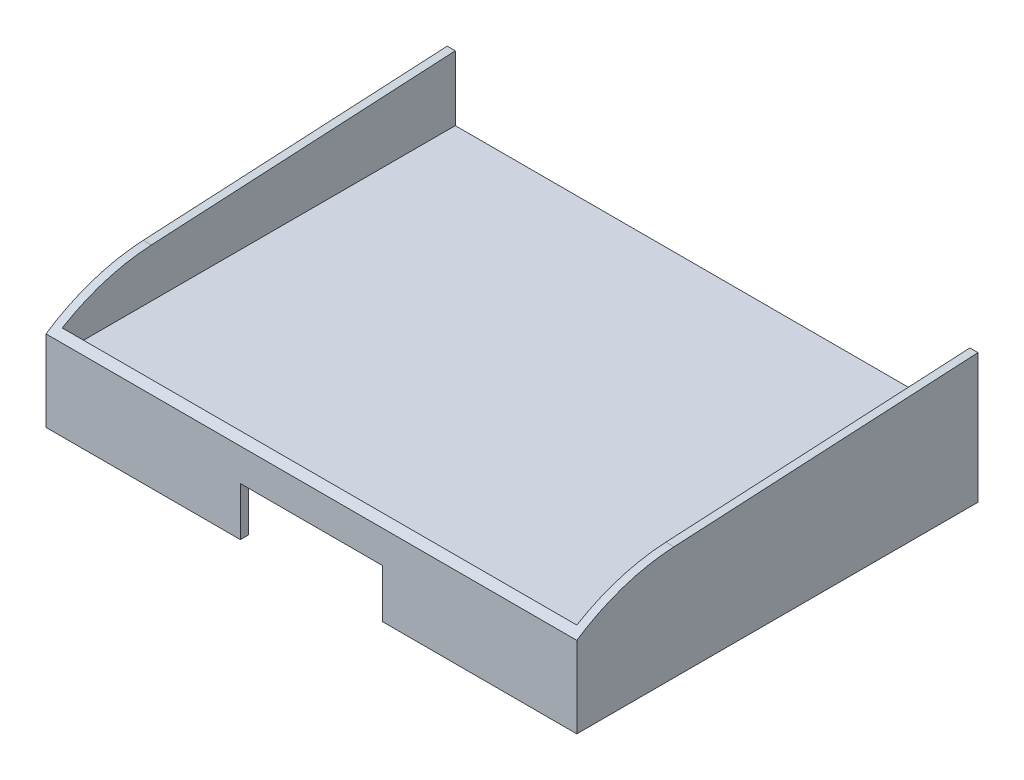
from build123d import *

# Parameters (mm, degrees)
SKETCH1_W           = 416.08
SKETCH1_H           = 314.48
BOSS_EXTRUDE2_DEPTH = 101.6
SKETCH2_W           = 403.38
SKETCH2_H           = 308.13
CUT_EXTRUDE1_DEPTH  = 320.090106675
CUT_EXTRUDE2_DEPTH  = 462.687674829
CUT_EXTRUDE3_REACH  = 415.528
SKETCH4_W           = 111.28
SKETCH4_H           = 38.1
SKETCH5_W           = 403.38
SKETCH5_H           = 12.7
BOSS_EXTRUDE3_DEPTH = 308.13


with BuildPart() as part:
    # Sketch1 → Boss-Extrude2 (new body)
    with BuildSketch(Plane(origin=(0, 0, 0), x_dir=(1, 0, 0), z_dir=(0, 1, 0))):
        with Locations((40.527, 15.127)):
            Rectangle(SKETCH1_W, SKETCH1_H)
    extrude(amount=BOSS_EXTRUDE2_DEPTH)

    # Sketch2 → Cut-Extrude1 (cut, through all)
    with BuildSketch(Plane(origin=(0, 101.6, 0), x_dir=(1, 0, 0), z_dir=(0, 1, 0))):
        with Locations((40.527, 18.302)):
            Rectangle(SKETCH2_W, SKETCH2_H)
    extrude(amount=-CUT_EXTRUDE1_DEPTH, mode=Mode.SUBTRACT)

    # Sketch3 → Cut-Extrude2 (cut, through all)
    with BuildSketch(Plane(origin=(248.567, 0, 0), x_dir=(0, 0, -1), z_dir=(1, 0, 0))):
        with BuildLine():
            Line((-142.113, 63.5), (-142.113, 101.6))
            Line((-142.113, 101.6), (172.367, 101.6))
            Line((172.367, 101.6), (-65.913, 88.9))
            ThreePointArc((-65.913, 88.9), (-105.728307199, 81.345921598), (-142.113, 63.5))
        make_face()
    extrude(amount=-CUT_EXTRUDE2_DEPTH, mode=Mode.SUBTRACT)

    # Sketch4 → Cut-Extrude3 (cut, up to next)
    with BuildSketch(Plane.XY.offset(142.113), mode=Mode.PRIVATE) as cut_extrude3_sk1:
        with Locations((40.527, 19.05)):
            Rectangle(SKETCH4_W, SKETCH4_H)
    cut_extrude3_tool1 = extrude(cut_extrude3_sk1.sketch, amount=-CUT_EXTRUDE3_REACH, mode=Mode.PRIVATE) & part.part
    add(cut_extrude3_tool1.solids().sort_by_distance((40.527, 19.05, 142.113))[0], mode=Mode.SUBTRACT)

    # Sketch5 → Boss-Extrude3 (add)
    with BuildSketch(Plane(origin=(0, 0, 135.763), x_dir=(-1, 0, 0), z_dir=(0, 0, -1))):
        with Locations((-40.527, 44.45)):
            Rectangle(SKETCH5_W, SKETCH5_H)
    extrude(amount=BOSS_EXTRUDE3_DEPTH)


solid = part.part
